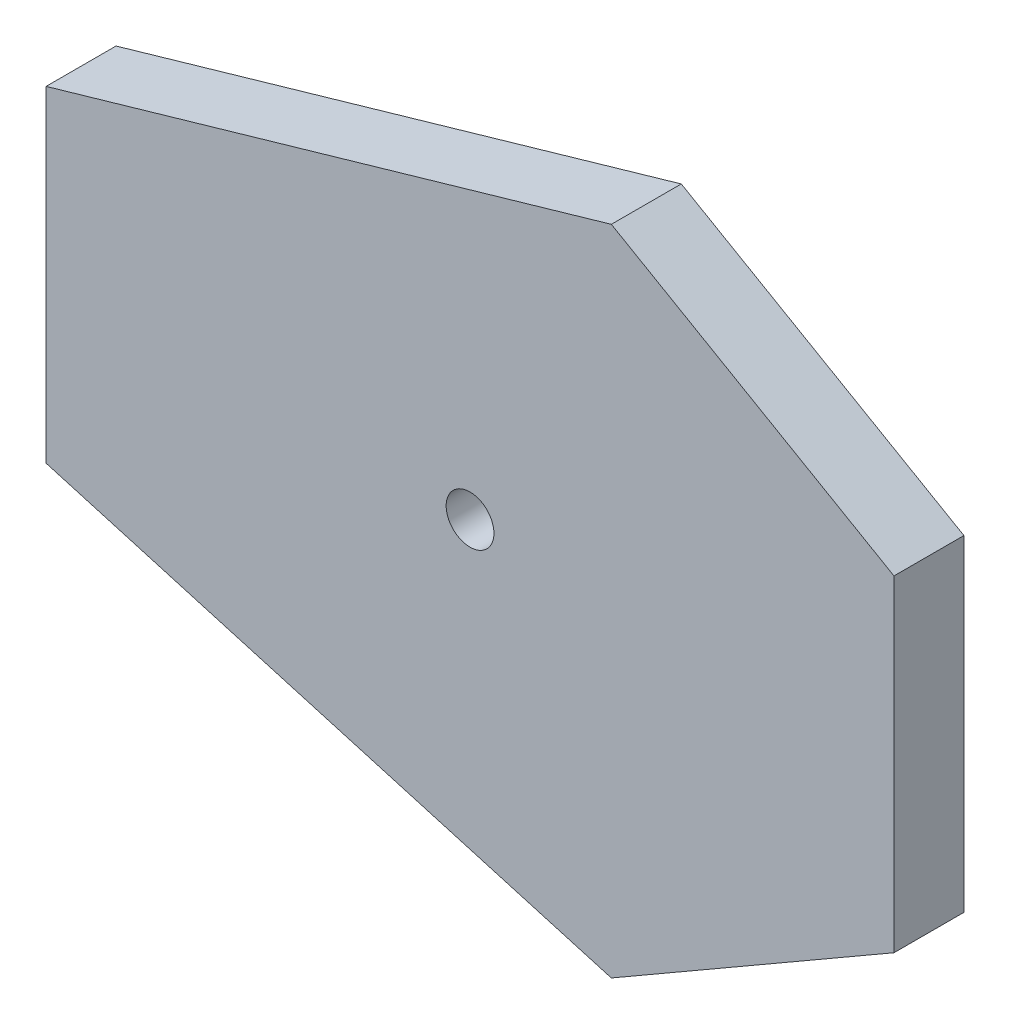
from build123d import *

# Parameters (mm, degrees)
SKETCH1_R           = 2.05
BOSS_EXTRUDE1_DEPTH = 6
SKETCH2_R           = 2.1
CUT_EXTRUDE1_DEPTH  = 3


with BuildPart() as part:
    # Sketch1 → Boss-Extrude1 (new body)
    with BuildSketch(Plane.XY):
        Polygon((-41.523066959, 14), (-41.523066959, -14), (6.974355653, -28), (31.223066959, -14), (31.223066959, 14), (6.974355653, 28), align=None)
        with Locations((-5.15, 0)):
            Circle(SKETCH1_R, mode=Mode.SUBTRACT)
    extrude(amount=BOSS_EXTRUDE1_DEPTH)

    # Sketch2 → Cut-Extrude1 (cut)
    with BuildSketch(Plane(origin=(0, 0, 0), x_dir=(-1, 0, 0), z_dir=(0, 0, -1))):
        with Locations((5.15, 0)):
            Circle(SKETCH2_R)
    extrude(amount=-CUT_EXTRUDE1_DEPTH, mode=Mode.SUBTRACT)


solid = part.part
